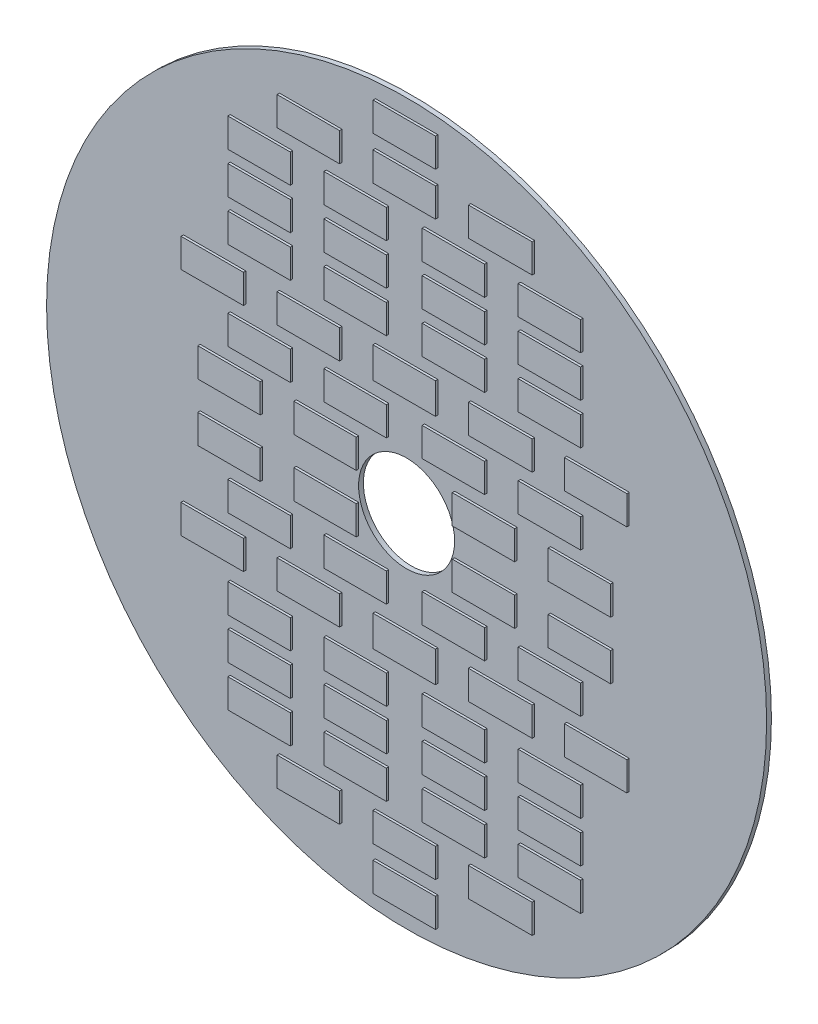
from build123d import *

# Parameters (mm, degrees)
SKETCH_2_R      = 750
SKETCH_2_R_2    = 100
EXTRUDE_1_DEPTH = 10
SKETCH_1_W      = 130
SKETCH_1_H      = 60
SKETCH_1_W_2    = 132.888940811
SKETCH_1_H_2    = 64.237478293
EXTRUDE_2_DEPTH = 15


with BuildPart() as part:
    # 草图2 → 凸台-拉伸1 (new body)
    with BuildSketch(Plane.XY):
        Circle(SKETCH_2_R)
        Circle(SKETCH_2_R_2, mode=Mode.SUBTRACT)
    extrude(amount=EXTRUDE_1_DEPTH)

    # 草图1 → 凸台-拉伸2 (add)
    with BuildSketch(Plane.XY):
        with Locations((165, 60)):
            Rectangle(SKETCH_1_W, SKETCH_1_H)
        with Locations((365, 60)):
            Rectangle(SKETCH_1_W, SKETCH_1_H)
        with Locations((102.356618967, 150)):
            Rectangle(SKETCH_1_W, SKETCH_1_H)
        with Locations((302.356618967, 150)):
            Rectangle(SKETCH_1_W, SKETCH_1_H)
        with Locations((102.356618967, 334.237478293)):
            Rectangle(SKETCH_1_W, SKETCH_1_H)
        with Locations((302.356618967, 334.237478293)):
            Rectangle(SKETCH_1_W, SKETCH_1_H)
        with Locations((200.169686036, 240)):
            Rectangle(SKETCH_1_W_2, SKETCH_1_H)
        with Locations((398.72521563, 240)):
            Rectangle(SKETCH_1_W, SKETCH_1_H)
        with Locations((0, 242.118739147)):
            Rectangle(SKETCH_1_W, SKETCH_1_H_2)
        with Locations((-199.830313965, 240)):
            Rectangle(SKETCH_1_W, SKETCH_1_H)
        with Locations((-399.830313965, 240)):
            Rectangle(SKETCH_1_W, SKETCH_1_H)
        with Locations((102.356618967, 420)):
            Rectangle(SKETCH_1_W, SKETCH_1_H)
        with Locations((302.356618967, 420)):
            Rectangle(SKETCH_1_W, SKETCH_1_H)
        with Locations((102.356618967, 505.762521707)):
            Rectangle(SKETCH_1_W, SKETCH_1_H)
        with Locations((302.356618967, 505.762521707)):
            Rectangle(SKETCH_1_W, SKETCH_1_H)
        with Locations((200.169686036, 595.762521707)):
            Rectangle(SKETCH_1_W_2, SKETCH_1_H)
        with Locations((0, 595.762521707)):
            Rectangle(SKETCH_1_W, SKETCH_1_H)
        with Locations((-199.830313965, 595.762521707)):
            Rectangle(SKETCH_1_W, SKETCH_1_H)
        with Locations((-365, 60)):
            Rectangle(SKETCH_1_W, SKETCH_1_H)
        with Locations((-165, 60)):
            Rectangle(SKETCH_1_W, SKETCH_1_H)
        with Locations((-102.356618967, 150)):
            Rectangle(SKETCH_1_W, SKETCH_1_H)
        with Locations((-302.356618967, 150)):
            Rectangle(SKETCH_1_W, SKETCH_1_H)
        with Locations((-102.356618967, 505.762521707)):
            Rectangle(SKETCH_1_W, SKETCH_1_H)
        with Locations((-302.356618967, 505.762521707)):
            Rectangle(SKETCH_1_W, SKETCH_1_H)
        with Locations((-102.356618967, 420)):
            Rectangle(SKETCH_1_W, SKETCH_1_H)
        with Locations((-302.356618967, 420)):
            Rectangle(SKETCH_1_W, SKETCH_1_H)
        with Locations((-102.356618967, 334.237478293)):
            Rectangle(SKETCH_1_W, SKETCH_1_H)
        with Locations((-302.356618967, 334.237478293)):
            Rectangle(SKETCH_1_W, SKETCH_1_H)
        with Locations((-102.356618967, -334.237478293)):
            Rectangle(SKETCH_1_W, SKETCH_1_H)
        with Locations((-302.356618967, -334.237478293)):
            Rectangle(SKETCH_1_W, SKETCH_1_H)
        with Locations((-102.356618967, -420)):
            Rectangle(SKETCH_1_W, SKETCH_1_H)
        with Locations((-302.356618967, -420)):
            Rectangle(SKETCH_1_W, SKETCH_1_H)
        with Locations((-102.356618967, -505.762521707)):
            Rectangle(SKETCH_1_W, SKETCH_1_H)
        with Locations((-302.356618967, -505.762521707)):
            Rectangle(SKETCH_1_W, SKETCH_1_H)
        with Locations((-302.356618967, -150)):
            Rectangle(SKETCH_1_W, SKETCH_1_H)
        with Locations((-102.356618967, -150)):
            Rectangle(SKETCH_1_W, SKETCH_1_H)
        with Locations((-165, -60)):
            Rectangle(SKETCH_1_W, SKETCH_1_H)
        with Locations((-365, -60)):
            Rectangle(SKETCH_1_W, SKETCH_1_H)
        with Locations((-199.830313965, -595.762521707)):
            Rectangle(SKETCH_1_W, SKETCH_1_H)
        with Locations((200.169686036, -595.762521707)):
            Rectangle(SKETCH_1_W_2, SKETCH_1_H)
        with Locations((0, -595.762521707)):
            Rectangle(SKETCH_1_W, SKETCH_1_H)
        with Locations((102.356618967, -505.762521707)):
            Rectangle(SKETCH_1_W, SKETCH_1_H)
        with Locations((302.356618967, -505.762521707)):
            Rectangle(SKETCH_1_W, SKETCH_1_H)
        with Locations((102.356618967, -420)):
            Rectangle(SKETCH_1_W, SKETCH_1_H)
        with Locations((302.356618967, -420)):
            Rectangle(SKETCH_1_W, SKETCH_1_H)
        with Locations((102.356618967, -334.237478293)):
            Rectangle(SKETCH_1_W, SKETCH_1_H)
        with Locations((302.356618967, -334.237478293)):
            Rectangle(SKETCH_1_W, SKETCH_1_H)
        with Locations((-399.830313965, -240)):
            Rectangle(SKETCH_1_W, SKETCH_1_H)
        with Locations((-199.830313965, -240)):
            Rectangle(SKETCH_1_W, SKETCH_1_H)
        with Locations((0, -242.118739147)):
            Rectangle(SKETCH_1_W, SKETCH_1_H_2)
        with Locations((200.169686036, -240)):
            Rectangle(SKETCH_1_W_2, SKETCH_1_H)
        with Locations((398.72521563, -240)):
            Rectangle(SKETCH_1_W, SKETCH_1_H)
        with Locations((102.356618967, -150)):
            Rectangle(SKETCH_1_W, SKETCH_1_H)
        with Locations((302.356618967, -150)):
            Rectangle(SKETCH_1_W, SKETCH_1_H)
        with Locations((365, -60)):
            Rectangle(SKETCH_1_W, SKETCH_1_H)
        with Locations((165, -60)):
            Rectangle(SKETCH_1_W, SKETCH_1_H)
        with Locations((0, 685.762521707)):
            Rectangle(SKETCH_1_W, SKETCH_1_H)
        with Locations((0, -685.762521707)):
            Rectangle(SKETCH_1_W, SKETCH_1_H)
    extrude(amount=EXTRUDE_2_DEPTH)


solid = part.part
